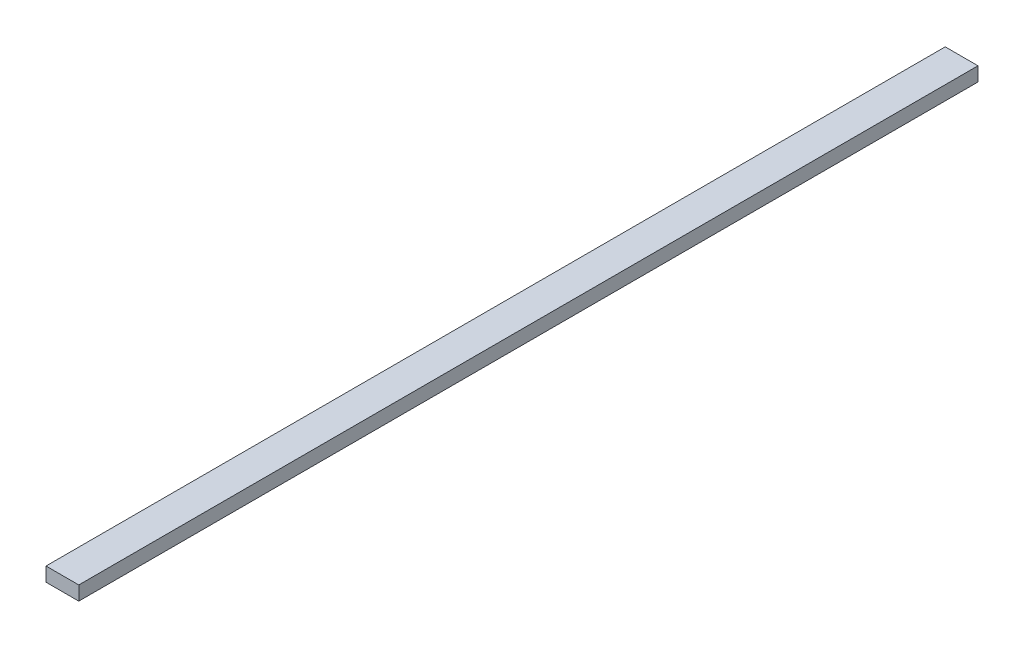
from build123d import *

# Parameters (mm, degrees)
SKETCH1_W           = 88.9
SKETCH1_H           = 38.1
BOSS_EXTRUDE1_DEPTH = 2438.4


with BuildPart() as part:
    # Sketch1 → Boss-Extrude1 (new body)
    with BuildSketch(Plane.XY):
        Rectangle(SKETCH1_W, SKETCH1_H)
    extrude(amount=BOSS_EXTRUDE1_DEPTH)


solid = part.part
